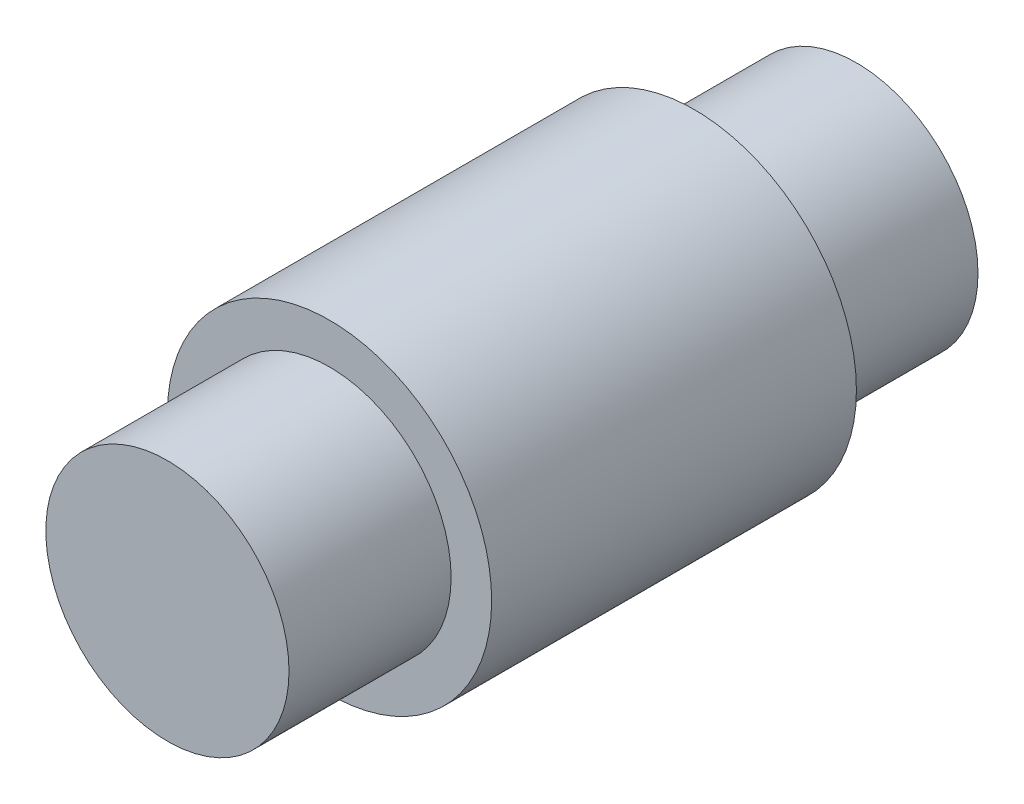
from build123d import *

# Parameters (mm, degrees)
ESQUISSE2_R        = 2
BOSS_EXTRU_1_DEPTH = 2.25
ESQUISSE3_R        = 1.5
BOSS_EXTRU_2_DEPTH = 2


with BuildPart() as part:
    # Esquisse2 → Boss.-Extru.1 (new body)
    with BuildSketch(Plane.XY):
        Circle(ESQUISSE2_R)
    boss_extru_1 = extrude(amount=BOSS_EXTRU_1_DEPTH)

    # Esquisse3 → Boss.-Extru.2 (add)
    with BuildSketch(Plane.XY.offset(2.25)):
        Circle(ESQUISSE3_R)
    boss_extru_2 = extrude(amount=BOSS_EXTRU_2_DEPTH)

    # Symétrie1: Boss.-Extru.1, Boss.-Extru.2 across plane
    add(boss_extru_1.mirror(Plane.XY))
    add(boss_extru_2.mirror(Plane.XY))


solid = part.part
